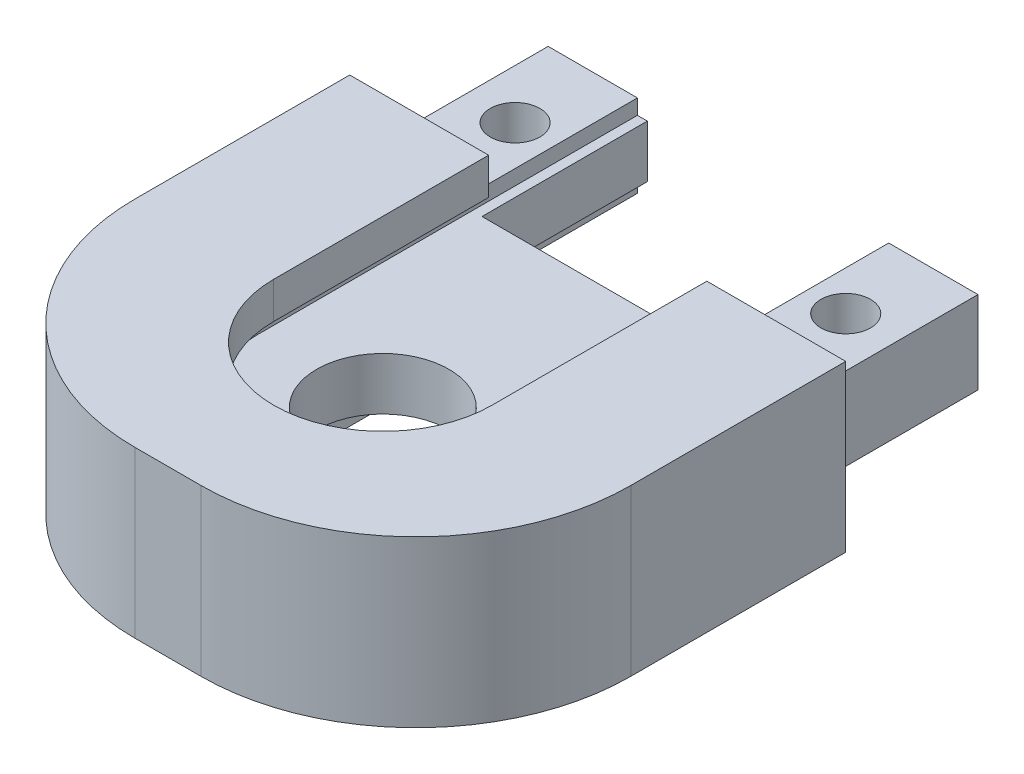
from build123d import *

# Parameters (mm, degrees)
SKETCH1_R           = 1.5
BOSS_EXTRUDE1_DEPTH = 5
SKETCH2_W           = 30
SKETCH2_H           = 2.5
BOSS_EXTRUDE2_DEPTH = 26
FILLET1_R           = 13
CUT_EXTRUDE1_START  = -13
CUT_EXTRUDE1_DEPTH  = 52.939054945
SKETCH4_R           = 7.6
CUT_EXTRUDE2_DEPTH  = 1.2
SKETCH5_R           = 6.6
CUT_EXTRUDE3_DEPTH  = 47.080312024
CUT_EXTRUDE4_START  = 1.2
SKETCH6_R           = 7.6
CUT_EXTRUDE4_DEPTH  = 1.2
SKETCH7_R           = 6.6
CUT_EXTRUDE5_DEPTH  = 47.080312024
SKETCH8_R           = 4
CUT_EXTRUDE6_DEPTH  = 47.080312024


with BuildPart() as part:
    # Sketch1 → Boss-Extrude1 (new body)
    with BuildSketch(Plane(origin=(0, 0, 0), x_dir=(1, 0, 0), z_dir=(0, 1, 0))):
        Polygon((0, 0), (6, 0), (6, -10), (20, -10), (20, 0), (26, 0), (26, -10), (28, -10), (28, -36), (-2, -36), (-2, -10), (0, -10), align=None)
        with Locations(Location((3, -5, 0), (0, 0, 270))):
            Circle(SKETCH1_R, mode=Mode.SUBTRACT)
        with Locations(Location((23, -5, 0), (0, 0, 90))):
            Circle(SKETCH1_R, mode=Mode.SUBTRACT)
    extrude(amount=BOSS_EXTRUDE1_DEPTH)

    # Sketch2 → Boss-Extrude2 (add)
    with BuildSketch(Plane.XY.offset(36)):
        with Locations((13, 6.25)):
            Rectangle(SKETCH2_W, SKETCH2_H)
        with Locations((13, -1.25)):
            Rectangle(SKETCH2_W, SKETCH2_H)
    extrude(amount=-BOSS_EXTRUDE2_DEPTH)

    # Fillet1
    fillet1_edges = [part.edges().sort_by_distance(p)[0] for p in [
        (28, 2.5, 36),
        (-2, 2.5, 36),
    ]]
    fillet(fillet1_edges, radius=FILLET1_R)

    # Sketch3 → Cut-Extrude1 (cut)
    with BuildSketch(Plane(origin=(0, 0, 10), x_dir=(-1, 0, 0), z_dir=(0, 0, -1)).offset(CUT_EXTRUDE1_START)):
        Polygon((-19.6, 7.5), (-19.6, 5.2875), (-20.6, 5.2875), (-20.6, 4.0875), (-13, 4.0875), (-5.4, 4.0875), (-5.4, 5.2875), (-6.4, 5.2875), (-6.4, 7.5), align=None)
    cut_extrude1 = extrude(amount=CUT_EXTRUDE1_DEPTH, mode=Mode.SUBTRACT)

    # Sketch4 → Cut-Extrude2 (cut)
    with BuildSketch(Plane(origin=(0, 4.0875, 0), x_dir=(1, 0, 0), z_dir=(0, 1, 0))):
        with Locations((13, -23)):
            Circle(SKETCH4_R)
    extrude(amount=CUT_EXTRUDE2_DEPTH, mode=Mode.SUBTRACT)

    # Sketch5 → Cut-Extrude3 (cut, through all)
    with BuildSketch(Plane(origin=(0, 4.0875, 0), x_dir=(1, 0, 0), z_dir=(0, 1, 0))):
        with Locations((13, -23)):
            Circle(SKETCH5_R)
    extrude(amount=CUT_EXTRUDE3_DEPTH, mode=Mode.SUBTRACT)

    # Mirror1: Cut-Extrude1 across plane
    add(cut_extrude1.mirror(Plane(origin=(0, 2.5, 0), x_dir=(0, 0, 1), z_dir=(0, -1, 0))), mode=Mode.SUBTRACT)

    # Sketch6 → Cut-Extrude4 (cut)
    with BuildSketch(Plane.XZ.offset(-0.9125).offset(CUT_EXTRUDE4_START)):
        with Locations((13, 23)):
            Circle(SKETCH6_R)
    extrude(amount=-CUT_EXTRUDE4_DEPTH, mode=Mode.SUBTRACT)

    # Sketch7 → Cut-Extrude5 (cut, through all)
    with BuildSketch(Plane.XZ.offset(-0.9125)):
        with Locations((13, 23)):
            Circle(SKETCH7_R)
    extrude(amount=CUT_EXTRUDE5_DEPTH, mode=Mode.SUBTRACT)

    # Sketch8 → Cut-Extrude6 (cut, through all)
    with BuildSketch(Plane(origin=(0, 4.0875, 0), x_dir=(1, 0, 0), z_dir=(0, 1, 0))):
        with Locations(Location((13, -23, 0), (0, 0, 270))):
            Circle(SKETCH8_R)
    extrude(amount=-CUT_EXTRUDE6_DEPTH, mode=Mode.SUBTRACT)


solid = part.part
